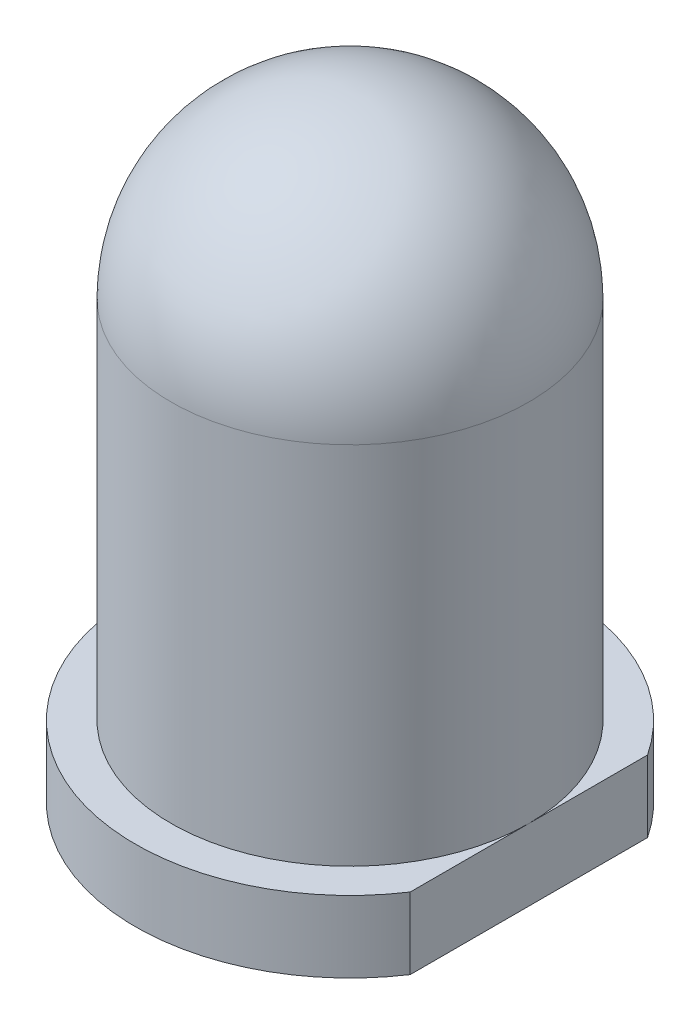
from build123d import *

# Parameters (mm, degrees)
SKETCH1_R           = 2.5
BOSS_EXTRUDE1_DEPTH = 8.6
SKETCH2_R           = 3
BOSS_EXTRUDE2_DEPTH = 1
SKETCH3_W           = 1.587859768
SKETCH3_H           = 6.214234813
CUT_EXTRUDE1_DEPTH  = 10.589577676
FILLET1_R           = 2.5


with BuildPart() as part:
    # Sketch1 → Boss-Extrude1 (new body)
    with BuildSketch(Plane(origin=(0, 0, 0), x_dir=(1, 0, 0), z_dir=(0, 1, 0))):
        with Locations(Location((0, 0, 0), (0, 0, 90))):
            Circle(SKETCH1_R)
    extrude(amount=BOSS_EXTRUDE1_DEPTH)

    # Sketch2 → Boss-Extrude2 (add)
    with BuildSketch(Plane.XZ):
        with Locations(Location((0, 0, 0), (0, 0, 270))):
            Circle(SKETCH2_R)
    extrude(amount=-BOSS_EXTRUDE2_DEPTH)

    # Sketch3 → Cut-Extrude1 (cut, through all)
    with BuildSketch(Plane.XZ):
        with Locations((3.293929884, 0.12901227)):
            Rectangle(SKETCH3_W, SKETCH3_H)
    extrude(amount=-CUT_EXTRUDE1_DEPTH, mode=Mode.SUBTRACT)

    # Fillet1
    fillet1_edges = [part.edges().sort_by_distance(p)[0] for p in [
        (0, 8.6, 2.5),
    ]]
    fillet(fillet1_edges, radius=FILLET1_R)


solid = part.part
